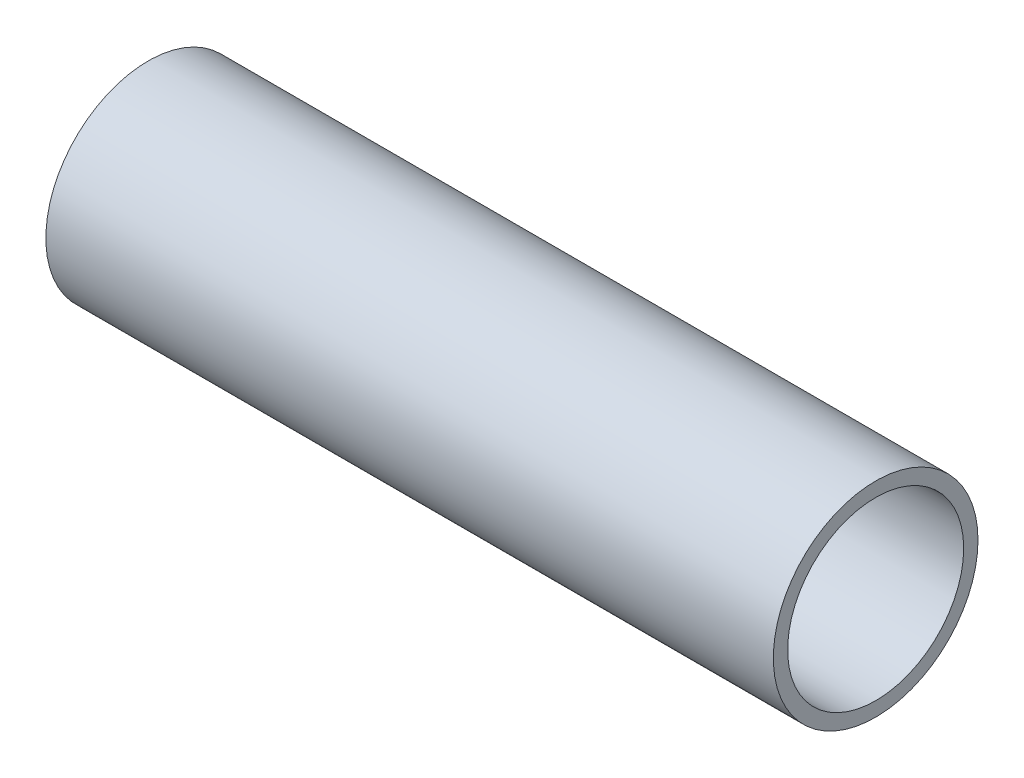
from build123d import *

# Parameters (mm, degrees)
SKETCH1_R           = 21.1
SKETCH1_R_2         = 18.15
BOSS_EXTRUDE1_DEPTH = 150


with BuildPart() as part:
    # Sketch1 → Boss-Extrude1 (new body)
    with BuildSketch(Plane(origin=(0, 0, 0), x_dir=(0, 0, -1), z_dir=(1, 0, 0))):
        Circle(SKETCH1_R)
        Circle(SKETCH1_R_2, mode=Mode.SUBTRACT)
    extrude(amount=BOSS_EXTRUDE1_DEPTH)


solid = part.part
